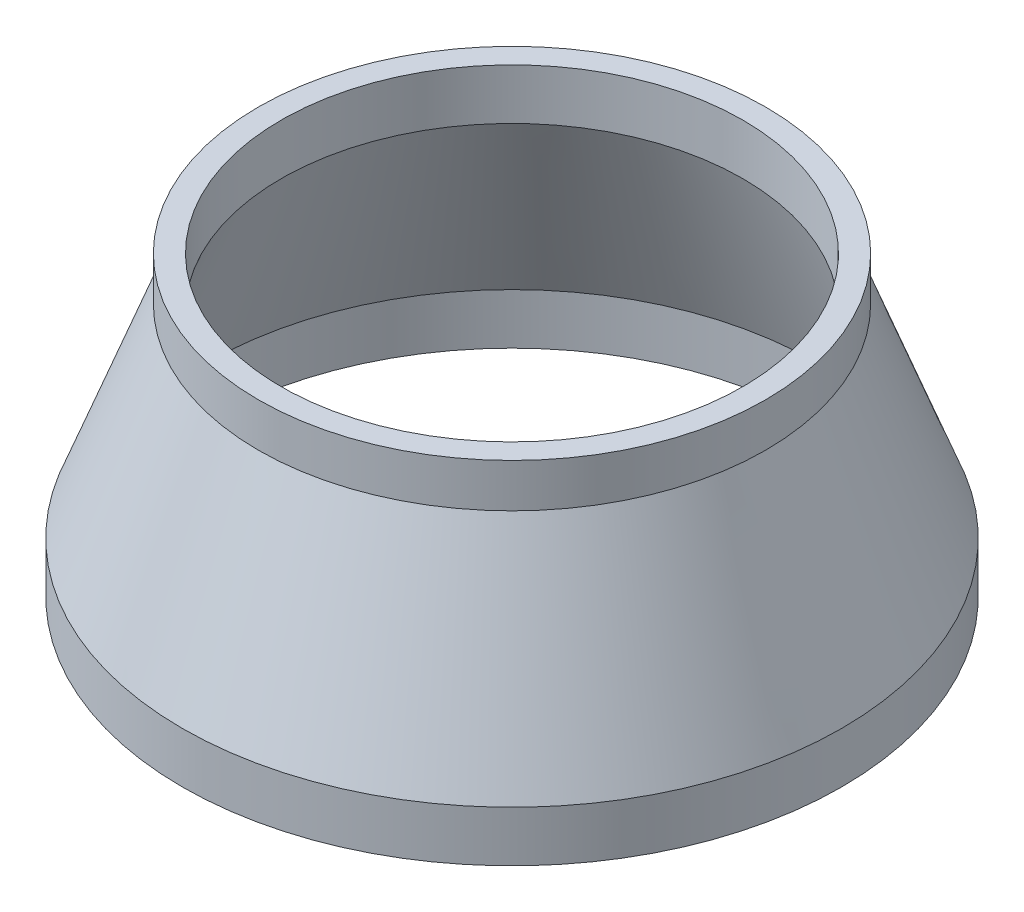
from build123d import *


with BuildPart() as part:
    # Sketch1 → Revolve3 (revolve)
    with BuildSketch(Plane.XY, mode=Mode.PRIVATE) as revolve3_sk:
        Polygon((38.1, 0), (28.906984113, 24.514709032), (28.906984113, 30.864709032), (31.75, 30.864709032), (31.75, 25.4), (41.275, 0), (41.275, -6.35), (38.1, -6.35), align=None)
    revolve(revolve3_sk.sketch.rotate(Axis((0, 0, 0), (0, 1, 0)), 90), axis=Axis((0, 0, 0), (0, 1, 0)))


solid = part.part
